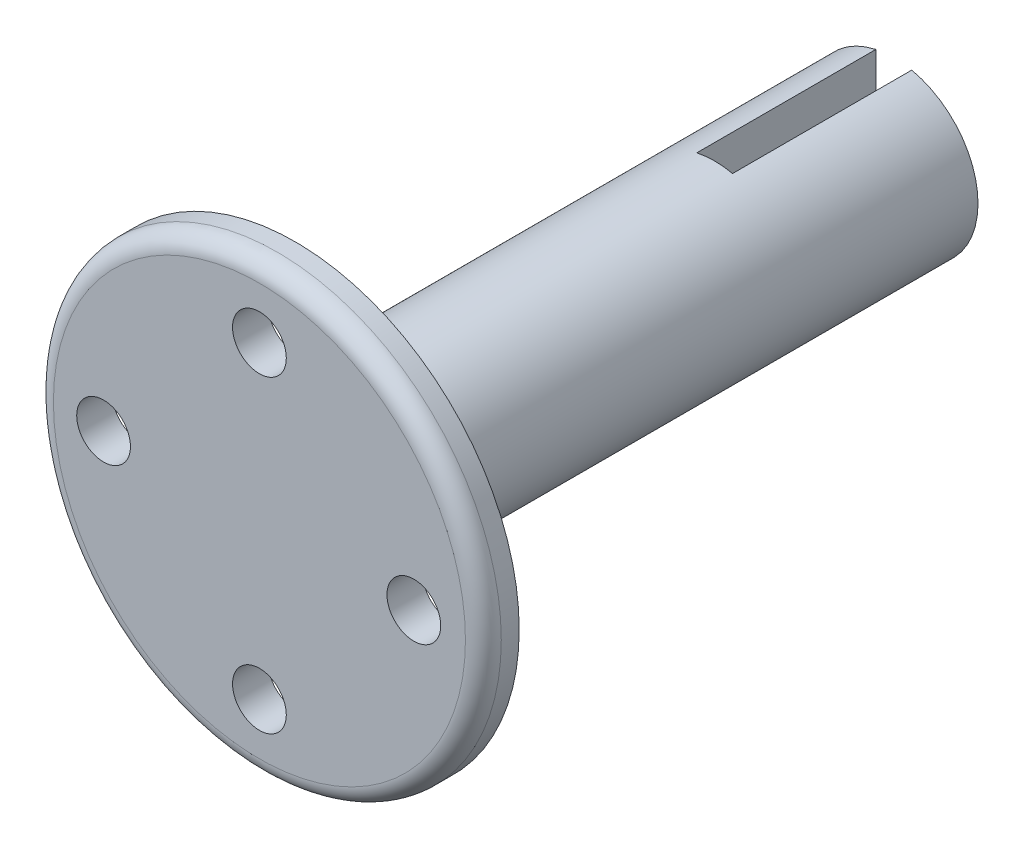
from build123d import *

# Parameters (mm, degrees)
CROQUIS1_R              = 12.5
SALIENTE_EXTRUIR1_DEPTH = 2
REDONDEO2_R             = 1
CROQUIS2_R              = 5
SALIENTE_EXTRUIR2_DEPTH = 33.41
CROQUIS3_R              = 1.5
CORTAR_EXTRUIR1_DEPTH   = 23.41
CORTAR_EXTRUIR2_START   = -10
CORTAR_EXTRUIR2_DEPTH   = 10
CORTAR_EXTRUIR7_START   = -33.41
CROQUIS9_R              = 5
CROQUIS9_R_2            = 4.7
CORTAR_EXTRUIR7_DEPTH   = 33.41


with BuildPart() as part:
    # Croquis1 → Saliente-Extruir1 (new body)
    with BuildSketch(Plane.XY):
        Circle(CROQUIS1_R)
    extrude(amount=SALIENTE_EXTRUIR1_DEPTH)

    # Redondeo2
    redondeo2_edges = [part.edges().sort_by_distance(p)[0] for p in [
        (-12.5, 0, 2),
    ]]
    fillet(redondeo2_edges, radius=REDONDEO2_R)

    # Croquis2 → Saliente-Extruir2 (add)
    with BuildSketch(Plane(origin=(0, 0, 0), x_dir=(-1, 0, 0), z_dir=(0, 0, -1))):
        Circle(CROQUIS2_R)
    extrude(amount=SALIENTE_EXTRUIR2_DEPTH)

    # Croquis3 → Cortar-Extruir1 (cut)
    with BuildSketch(Plane(origin=(0, 0, 0), x_dir=(-1, 0, 0), z_dir=(0, 0, -1))):
        with Locations((0, 8.62)):
            Circle(CROQUIS3_R)
        with Locations((-8.62, 0)):
            Circle(CROQUIS3_R)
        with Locations((8.7, 0)):
            Circle(CROQUIS3_R)
        with Locations((0, -8.62)):
            Circle(CROQUIS3_R)
    extrude(amount=-CORTAR_EXTRUIR1_DEPTH, mode=Mode.SUBTRACT)

    # Croquis4 → Cortar-Extruir2 (cut)
    with BuildSketch(Plane(origin=(0, 0, -33.41), x_dir=(-1, 0, 0), z_dir=(0, 0, -1)).offset(CORTAR_EXTRUIR2_START)):
        with BuildLine():
            Line((-1, 4.898979486), (-1, 1.732050808))
            ThreePointArc((-1, 1.732050808), (-1.547786782, -1.266631784), (1.5, -1.322875656))
            Line((1.5, -1.322875656), (1.5, 1.322875656))
            ThreePointArc((1.5, 1.322875656), (1.266631784, 1.547786782), (1, 1.732050808))
            Line((1, 1.732050808), (1, 4.898979486))
            ThreePointArc((1, 4.898979486), (0, 5), (-1, 4.898979486))
        make_face()
    extrude(amount=CORTAR_EXTRUIR2_DEPTH, mode=Mode.SUBTRACT)

    # Croquis9 → Cortar-Extruir7 (cut)
    with BuildSketch(Plane(origin=(0, 0, -33.41), x_dir=(-1, 0, 0), z_dir=(0, 0, -1)).offset(CORTAR_EXTRUIR7_START)):
        Circle(CROQUIS9_R)
        with Locations(Location((0, 0, 0), (0, 0, 77.715506144))):
            Circle(CROQUIS9_R_2, mode=Mode.SUBTRACT)
    extrude(amount=CORTAR_EXTRUIR7_DEPTH, mode=Mode.SUBTRACT)


solid = part.part
